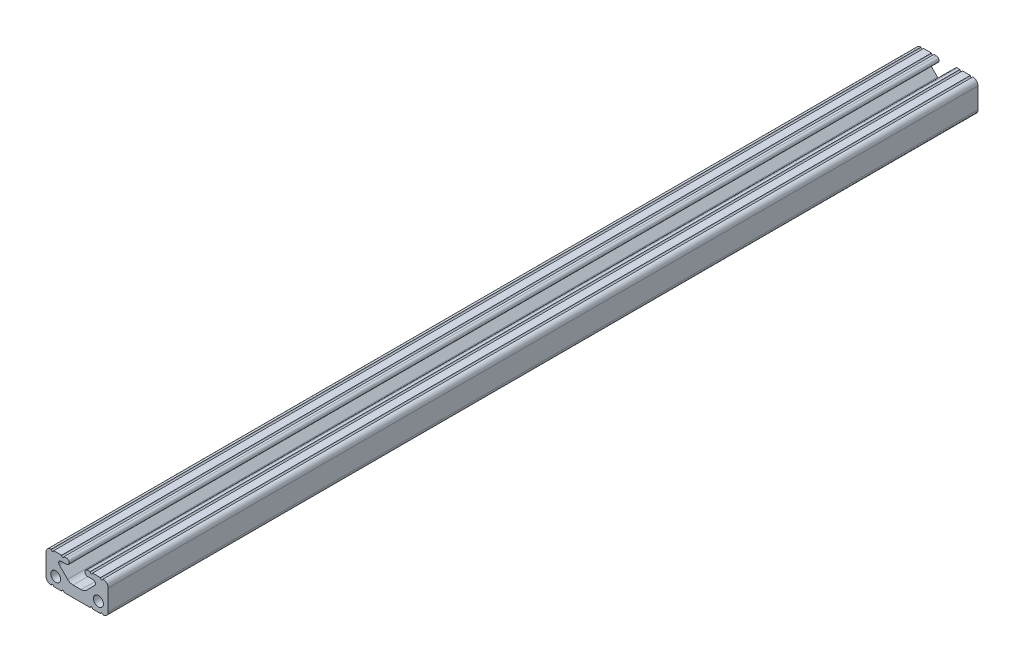
from build123d import *

# Parameters (mm, degrees)
SKETCH1_R           = 2.032
BOSS_EXTRUDE1_DEPTH = 177.8


with BuildPart() as part:
    # Sketch1 → Boss-Extrude1 (new, symmetric)
    with BuildSketch(Plane.XY):
        with BuildLine():
            Line((-12.7, 10.591838253), (-12.7, 2.108161747))
            ThreePointArc((-12.7, 2.108161747), (-12.078025605, 0.612955845), (-10.5791, 0))
            ThreePointArc((-10.5791, 0), (-10.06475, 0.508039196), (-9.5504, 0))
            Line((-9.5504, 0), (-6.3246, 0))
            ThreePointArc((-6.3246, 0), (-5.8166, 0.508), (-5.3086, 0))
            Line((-5.3086, 0), (5.3086, 0))
            ThreePointArc((5.3086, 0), (5.8166, 0.508), (6.3246, 0))
            Line((6.3246, 0), (9.5504, 0))
            ThreePointArc((9.5504, 0), (10.06475, 0.508039196), (10.5791, 0))
            ThreePointArc((10.5791, 0), (12.078025605, 0.612955845), (12.7, 2.108161747))
            Line((12.7, 2.108161747), (12.7, 10.591838253))
            ThreePointArc((12.7, 10.591838253), (12.078025605, 12.087044155), (10.5791, 12.7))
            ThreePointArc((10.5791, 12.7), (10.06475, 12.191960804), (9.5504, 12.7))
            Line((9.5504, 12.7), (6.3246, 12.7))
            ThreePointArc((6.3246, 12.7), (5.816599999, 12.191999983), (5.3086, 12.700000002))
            Line((5.3086, 12.700000002), (4.302307889, 12.700000002))
            ThreePointArc((4.302307889, 12.700000002), (3.197407889, 11.595100002), (4.302307889, 10.490200002))
            Line((4.302307889, 10.490200002), (6.487959021, 10.490200002))
            ThreePointArc((6.487959021, 10.490200002), (7.426620626, 9.863006369), (7.20637951, 8.755779512))
            Line((7.20637951, 8.755779512), (3.87633597, 5.425735971))
            ThreePointArc((3.87633597, 5.425735971), (2.846291837, 4.737482486), (1.631271939, 4.495800002))
            Line((1.631271939, 4.495800002), (-1.631271939, 4.495800002))
            ThreePointArc((-1.631271939, 4.495800002), (-2.846291837, 4.737482486), (-3.87633597, 5.425735971))
            Line((-3.87633597, 5.425735971), (-7.20637951, 8.755779512))
            ThreePointArc((-7.20637951, 8.755779512), (-7.426620626, 9.863006369), (-6.487959021, 10.490200002))
            Line((-6.487959021, 10.490200002), (-4.302307889, 10.490200002))
            ThreePointArc((-4.302307889, 10.490200002), (-3.197407889, 11.595100002), (-4.302307889, 12.700000002))
            Line((-4.302307889, 12.700000002), (-5.3086, 12.700000002))
            ThreePointArc((-5.3086, 12.700000002), (-5.816599999, 12.191999985), (-6.3246, 12.7))
            Line((-6.3246, 12.7), (-9.5504, 12.7))
            ThreePointArc((-9.5504, 12.7), (-10.06475, 12.191960804), (-10.5791, 12.7))
            ThreePointArc((-10.5791, 12.7), (-12.078025605, 12.087044155), (-12.7, 10.591838253))
        make_face()
        with Locations((-8.73125, 3.9624)):
            Circle(SKETCH1_R, mode=Mode.SUBTRACT)
        with Locations((8.73125, 3.9624)):
            Circle(SKETCH1_R, mode=Mode.SUBTRACT)
    extrude(amount=BOSS_EXTRUDE1_DEPTH, both=True)


solid = part.part
